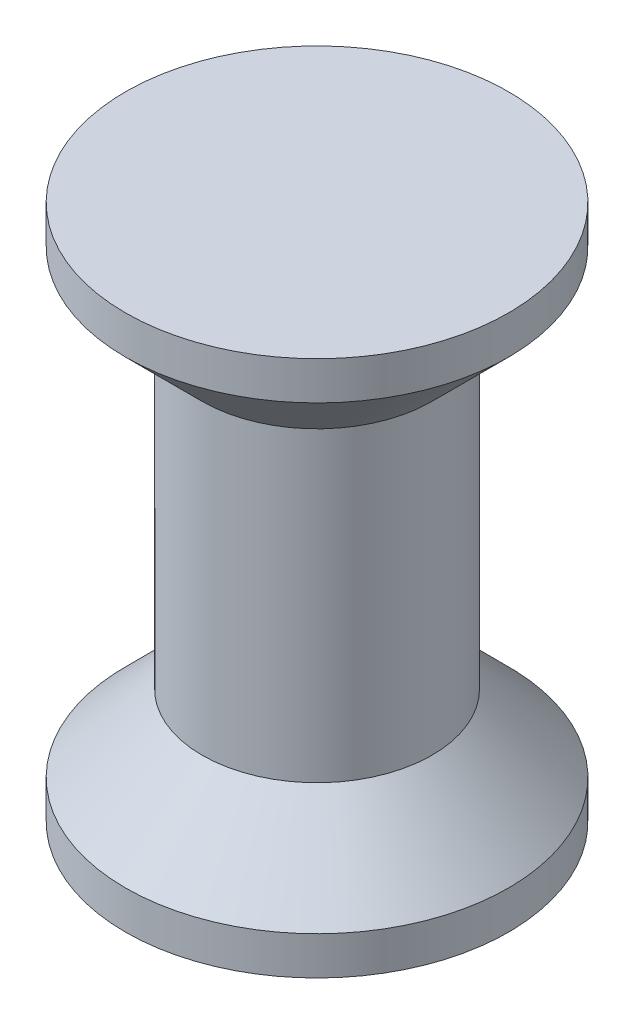
from build123d import *


with BuildPart() as part:
    # 草图1 → 旋转1 (revolve)
    with BuildSketch(Plane.XY, mode=Mode.PRIVATE) as revolve_1_sk:
        Polygon((0, 35), (25, 35), (25, 30), (15, 20), (15, -20), (25, -30), (25, -35), (0, -35), align=None)
    revolve(revolve_1_sk.sketch.rotate(Axis((0, 35, 0), (0, -1, 0)), 90), axis=Axis((0, 35, 0), (0, -1, 0)))


solid = part.part
